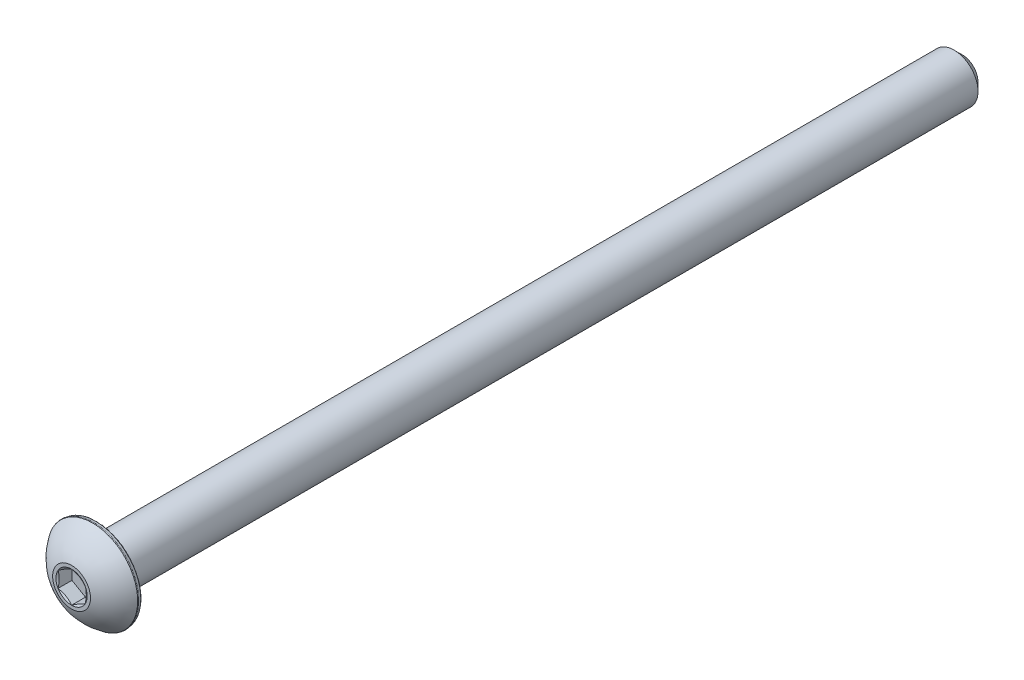
from build123d import *

# Parameters (mm, degrees)
CUT_EXTRUDE1_DEPTH = 1.01981
FILLET1_R          = 0.09271


with BuildPart() as part:
    # Sketch3 → Revolve1 (revolve)
    with BuildSketch(Plane(origin=(0, 0, 0), x_dir=(0, 0, -1), z_dir=(1, 0, 0)), mode=Mode.PRIVATE) as revolve1_sk:
        with BuildLine():
            Line((-32.6771, 0), (-32.6771, 1.3890625))
            ThreePointArc((-32.6771, 1.3890625), (-32.046710995, 2.486413841), (-31.10103, 3.3274))
            Line((-31.10103, 3.3274), (-30.8229, 3.278358177))
            Line((-30.8229, 3.278358177), (-30.8229, 1.7526))
            Line((-30.8229, 1.7526), (32.0817875, 1.7526))
            Line((32.0817875, 1.7526), (32.6771, 1.1572875))
            Line((32.6771, 1.1572875), (32.6771, 0))
            Line((32.6771, 0), (-32.6771, 0))
        make_face()
    revolve(revolve1_sk.sketch.rotate(Axis((0, 0, 32.6771), (0, 0, -1)), 90), axis=Axis((0, 0, 32.6771), (0, 0, -1)))

    # Sketch4 → Cut-Extrude1 (cut)
    with BuildSketch(Plane.XY.offset(32.6771)):
        Polygon((-0.9921875, -0.57283972), (0, -1.14567944), (0.9921875, -0.57283972), (0.9921875, 0.57283972), (0, 1.14567944), (-0.9921875, 0.57283972), align=None)
    extrude(amount=-CUT_EXTRUDE1_DEPTH, mode=Mode.SUBTRACT)

    # Cut-Extrude2 cone 1 section (through the dimple's axis) → Cut-Extrude2 (revolve, cut)
    with BuildSketch(Plane(origin=(0, 0, 32.6771), x_dir=(0, -1, 0), z_dir=(1, 0, 0))):
        Polygon((0, 0), (1.14567944, 0), (0, 0.661458333), align=None)
    revolve(axis=Axis((0, 0, 32.6771), (0, 0, -1)), mode=Mode.SUBTRACT)

    # Fillet1
    fillet1_edges = [part.edges().sort_by_distance(p)[0] for p in [
        (-3.278358177, 0, 30.8229),
        (-3.3274, 0, 31.10103),
    ]]
    fillet(fillet1_edges, radius=FILLET1_R)


solid = part.part
